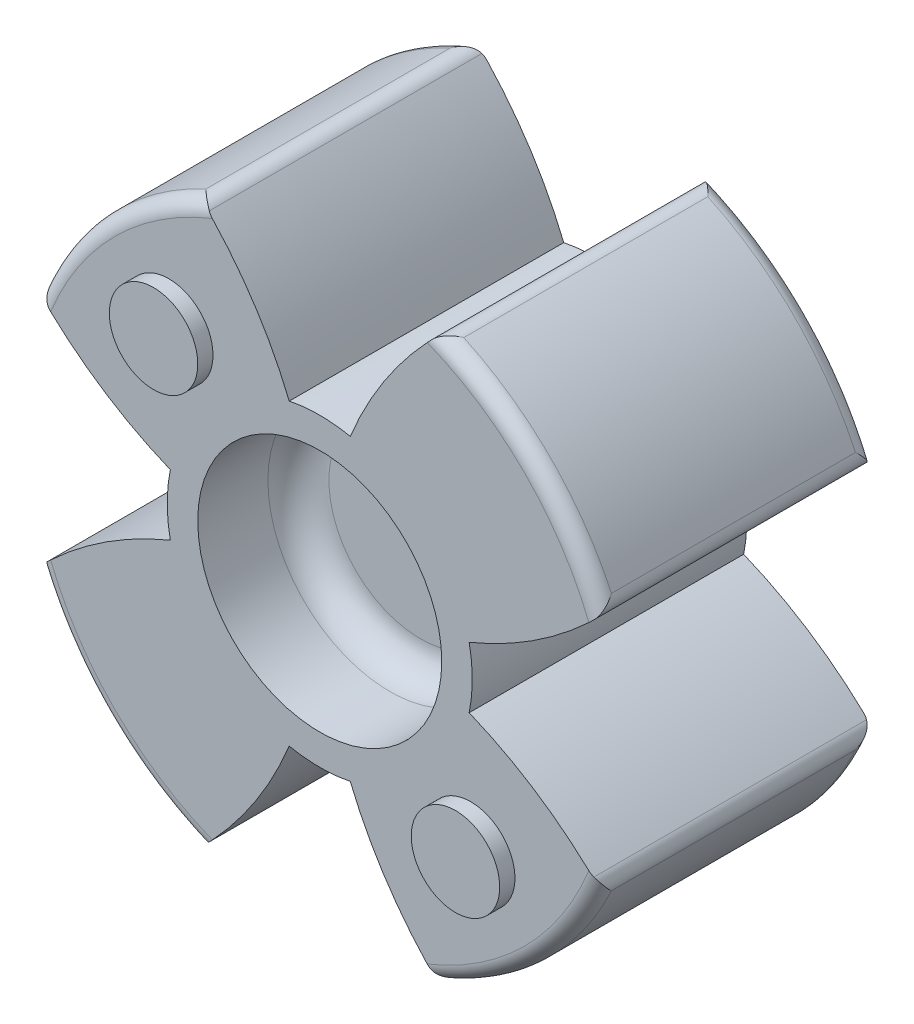
from build123d import *

# Parameters (mm, degrees)
EXTRUDE_1_DEPTH     = 9
SKETCH_2_R          = 1.45
EXTRUDE_2_DEPTH     = 0.5
SKETCH_3_R          = 1.45
EXTRUDE_3_DEPTH     = 0.5
SKETCH_4_R          = 4
CUT_EXTRUDE_1_DEPTH = 3.3
CUT_EXTRUDE_START   = -3.3
SKETCH_5_R          = 4
CUT_EXTRUDE_2_DEPTH = 3.3
FILLET_1_R          = 1
FILLET_2_R          = 0.5


with BuildPart() as part:
    # ｽｹｯﾁ1 → ﾎﾞｽ - 押し出し1 (new body)
    with BuildSketch(Plane.XY):
        with BuildLine():
            ThreePointArc((-1, -4.898979486), (0, -5), (1, -4.898979486))
            ThreePointArc((1, -4.898979486), (2.230832692, -7.201060023), (3.9, -9.208148565))
            ThreePointArc((3.9, -9.208148565), (7.071067812, -7.071067812), (9.208148565, -3.9))
            ThreePointArc((9.208148565, -3.9), (7.201060023, -2.230832692), (4.898979486, -1))
            ThreePointArc((4.898979486, -1), (5, 0), (4.898979486, 1))
            ThreePointArc((4.898979486, 1), (7.201060023, 2.230832692), (9.208148565, 3.9))
            ThreePointArc((9.208148565, 3.9), (7.071067812, 7.071067812), (3.9, 9.208148565))
            ThreePointArc((3.9, 9.208148565), (2.230832692, 7.201060023), (1, 4.898979486))
            ThreePointArc((1, 4.898979486), (0, 5), (-1, 4.898979486))
            ThreePointArc((-1, 4.898979486), (-2.230832692, 7.201060023), (-3.9, 9.208148565))
            ThreePointArc((-3.9, 9.208148565), (-7.071067812, 7.071067812), (-9.208148565, 3.9))
            ThreePointArc((-9.208148565, 3.9), (-7.201060023, 2.230832692), (-4.898979486, 1))
            ThreePointArc((-4.898979486, 1), (-5, 0), (-4.898979486, -1))
            ThreePointArc((-4.898979486, -1), (-7.201060023, -2.230832692), (-9.208148565, -3.9))
            ThreePointArc((-9.208148565, -3.9), (-7.071067812, -7.071067812), (-3.9, -9.208148565))
            ThreePointArc((-3.9, -9.208148565), (-2.230832692, -7.201060023), (-1, -4.898979486))
        make_face()
    extrude(amount=EXTRUDE_1_DEPTH)

    # ｽｹｯﾁ2 → ﾎﾞｽ - 押し出し2 (add)
    with BuildSketch(Plane.XY.offset(9)):
        with Locations((-4.949747468, 4.949747468)):
            Circle(SKETCH_2_R)
        with Locations(Location((4.949747468, -4.949747468, 0), (0, 0, 180))):
            Circle(SKETCH_2_R)
    extrude(amount=EXTRUDE_2_DEPTH)

    # ｽｹｯﾁ3 → ﾎﾞｽ - 押し出し3 (add)
    with BuildSketch(Plane(origin=(0, 0, 0), x_dir=(-1, 0, 0), z_dir=(0, 0, -1))):
        with Locations(Location((-4.949747468, 4.949747468, 0), (0, 0, 180))):
            Circle(SKETCH_3_R)
        with Locations(Location((4.949747468, -4.949747468, 0), (0, 0, 180))):
            Circle(SKETCH_3_R)
    extrude(amount=EXTRUDE_3_DEPTH)

    # ｽｹｯﾁ4 → ｶｯﾄ - 押し出し1 (cut)
    with BuildSketch(Plane.XY.offset(9)):
        Circle(SKETCH_4_R)
    extrude(amount=-CUT_EXTRUDE_1_DEPTH, mode=Mode.SUBTRACT)

    # ｽｹｯﾁ5 → ｶｯﾄ - 押し出し2 (cut)
    with BuildSketch(Plane(origin=(0, 0, 0), x_dir=(-1, 0, 0), z_dir=(0, 0, -1)).offset(CUT_EXTRUDE_START)):
        with Locations(Location((0, 0, 0), (0, 0, 180))):
            Circle(SKETCH_5_R)
    extrude(amount=CUT_EXTRUDE_2_DEPTH, mode=Mode.SUBTRACT)

    # ﾌｨﾚｯﾄ1
    fillet_1_edges = [part.edges().sort_by_distance(p)[0] for p in [
        (-4, 0, 5.7),
        (-4, 0, 3.3),
    ]]
    fillet(fillet_1_edges, radius=FILLET_1_R)

    # ﾌｨﾚｯﾄ2
    fillet_2_edges = [part.edges().sort_by_distance(p)[0] for p in [
        (7.071067812, -7.071067812, 0),
        (-7.071067812, 7.071067812, 9),
        (-7.071067812, -7.071067812, 0),
        (-7.071067812, 7.071067812, 0),
        (7.071067812, 7.071067812, 0),
        (9.208148565, 3.9, 4.5),
        (9.208148565, -3.9, 4.5),
        (3.9, -9.208148565, 4.5),
        (-3.9, -9.208148565, 4.5),
        (-9.208148565, -3.9, 4.5),
        (-9.208148565, 3.9, 4.5),
        (-3.9, 9.208148565, 4.5),
        (3.9, 9.208148565, 4.5),
        (-7.071067812, -7.071067812, 9),
        (7.071067812, 7.071067812, 9),
        (7.071067812, -7.071067812, 9),
    ]]
    fillet(fillet_2_edges, radius=FILLET_2_R)


solid = part.part
